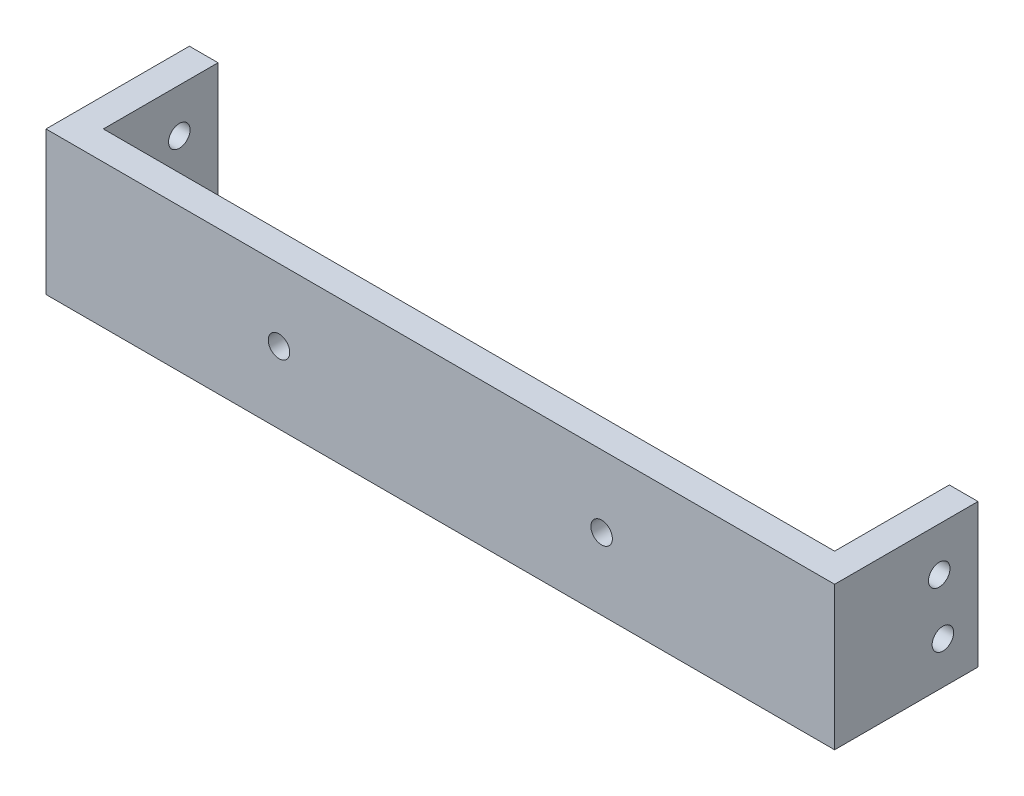
from build123d import *

# Parameters (mm, degrees)
SKETCH1_W           = 110
SKETCH1_H           = 4
SKETCH1_W_2         = 4
SKETCH1_H_2         = 16
BOSS_EXTRUDE1_DEPTH = 20
SKETCH2_R           = 1.5
CUT_EXTRUDE1_DEPTH  = 114.243101335
SKETCH3_R           = 1.5
CUT_EXTRUDE2_DEPTH  = 62.846584384


with BuildPart() as part:
    # Sketch1 → Boss-Extrude1 (new body)
    with BuildSketch(Plane(origin=(0, 0, 0), x_dir=(1, 0, 0), z_dir=(0, 1, 0))):
        Rectangle(SKETCH1_W, SKETCH1_H)
        with Locations((-53, 10)):
            Rectangle(SKETCH1_W_2, SKETCH1_H_2)
        with Locations((53, 10)):
            Rectangle(SKETCH1_W_2, SKETCH1_H_2)
    extrude(amount=BOSS_EXTRUDE1_DEPTH)

    # Sketch2 → Cut-Extrude1 (cut, through all)
    with BuildSketch(Plane(origin=(55, 0, 0), x_dir=(0, 0, -1), z_dir=(1, 0, 0))):
        with Locations((12.593610515, 13.86730529)):
            Circle(SKETCH2_R)
        with Locations((13.103987848, 5.882981905)):
            Circle(SKETCH2_R)
    extrude(amount=-CUT_EXTRUDE1_DEPTH, mode=Mode.SUBTRACT)

    # Sketch3 → Cut-Extrude2 (cut, through all)
    with BuildSketch(Plane.XY.offset(2)):
        with Locations((22.5, 10)):
            Circle(SKETCH3_R)
        with Locations((-22.5, 10)):
            Circle(SKETCH3_R)
    extrude(amount=-CUT_EXTRUDE2_DEPTH, mode=Mode.SUBTRACT)


solid = part.part
